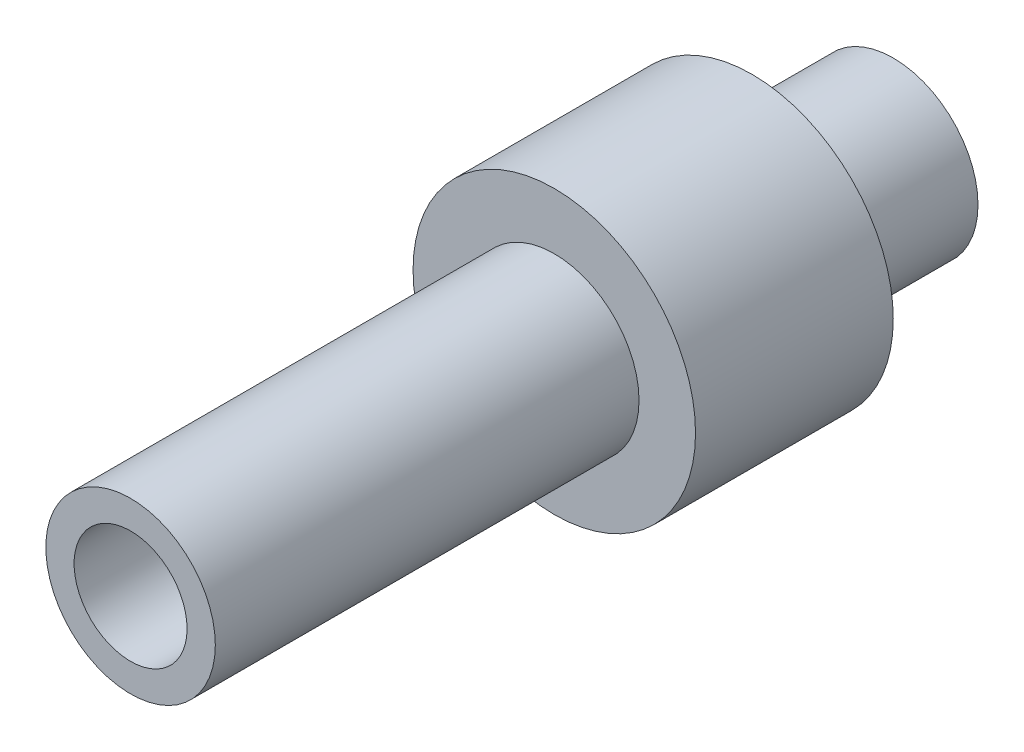
from build123d import *

# Parameters (mm, degrees)
SKETCH_1_R          = 5
EXTRUDE_1_DEPTH     = 7
SKETCH_2_R          = 3
EXTRUDE_2_DEPTH     = 15
EXTRUDE_START       = 5
SKETCH_3_R          = 3
EXTRUDE_3_DEPTH     = 5
SKETCH_4_R          = 2
CUT_EXTRUDE_1_DEPTH = 27


with BuildPart() as part:
    # 스케치1 → 돌출1 (new body)
    with BuildSketch(Plane.XY):
        Circle(SKETCH_1_R)
    extrude(amount=EXTRUDE_1_DEPTH)

    # 스케치2 → 돌출2 (add)
    with BuildSketch(Plane.XY.offset(7)):
        Circle(SKETCH_2_R)
    extrude(amount=EXTRUDE_2_DEPTH)

    # 스케치3 → 돌출3 (add)
    with BuildSketch(Plane(origin=(0, 0, 0), x_dir=(-1, 0, 0), z_dir=(0, 0, -1)).offset(EXTRUDE_START)):
        with Locations(Location((0, 0, 0), (0, 0, 180))):
            Circle(SKETCH_3_R)
    extrude(amount=-EXTRUDE_3_DEPTH)

    # 스케치4 → 컷-돌출1 (cut)
    with BuildSketch(Plane.XY.offset(22)):
        Circle(SKETCH_4_R)
    extrude(amount=-CUT_EXTRUDE_1_DEPTH, mode=Mode.SUBTRACT)


solid = part.part
